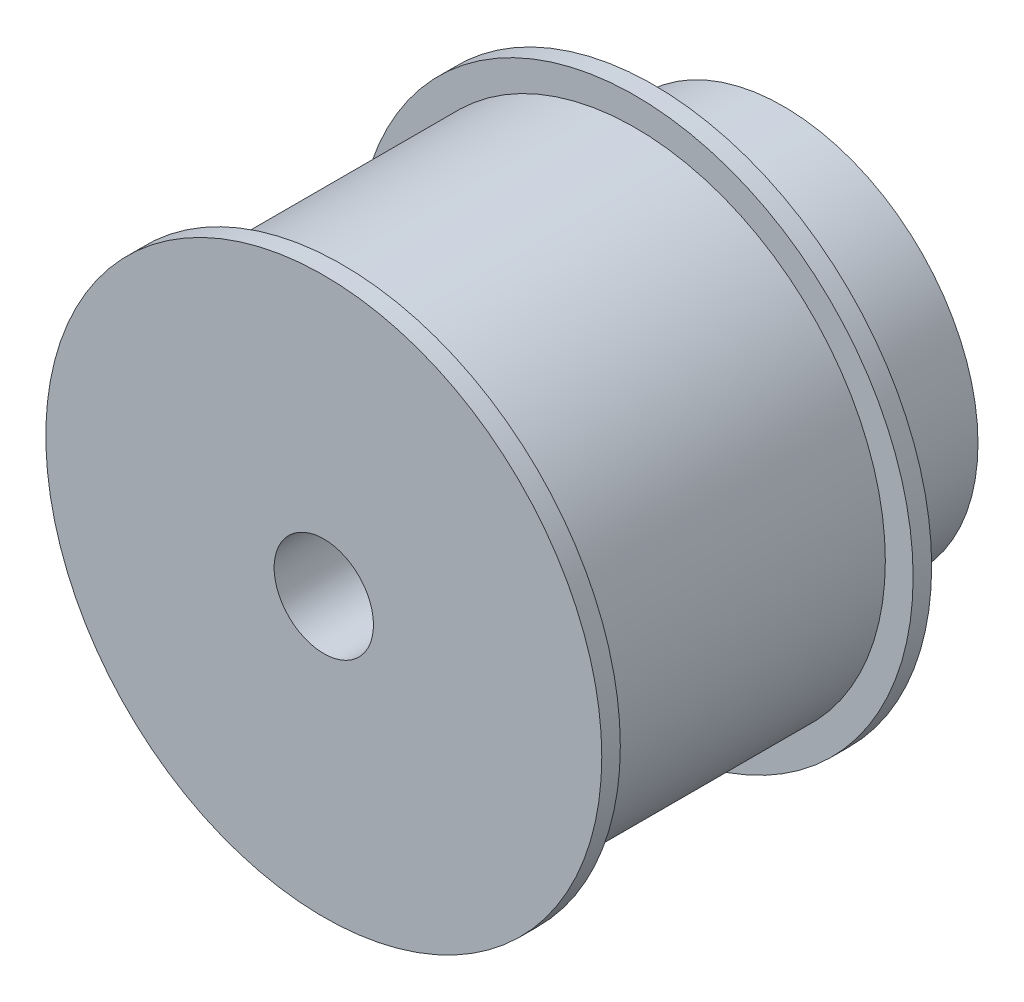
from build123d import *


with BuildPart() as part:
    # Sketch1 → Revolve1 (revolve)
    with BuildSketch(Plane(origin=(0, 0, 0), x_dir=(0, 0, -1), z_dir=(1, 0, 0)), mode=Mode.PRIVATE) as revolve1_sk:
        Polygon((0, 2.68), (0, 15), (1, 15), (1, 13.5), (16.8, 13.5), (16.8, 15), (17.8, 15), (17.8, 10.5), (24.8, 10.5), (24.8, 2.68), align=None)
    revolve(revolve1_sk.sketch.rotate(Axis((0, 0, 0), (0, 0, -1)), 90), axis=Axis((0, 0, 0), (0, 0, -1)))


solid = part.part
